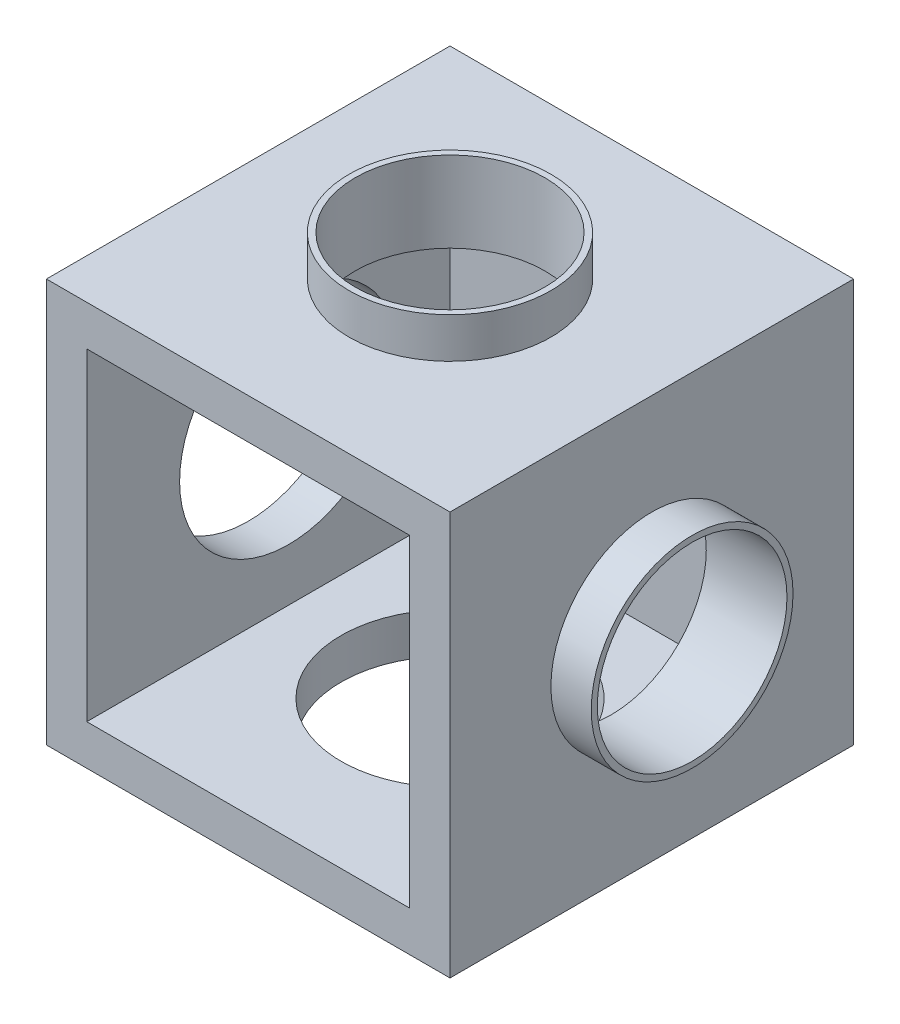
from build123d import *

# Parameters (mm, degrees)
SKETCH1_W           = 50
SKETCH1_H           = 50
BOSS_EXTRUDE1_DEPTH = 50
SKETCH2_W           = 40
SKETCH2_H           = 40
CUT_EXTRUDE1_DEPTH  = 45
SKETCH3_R           = 12.5
BOSS_EXTRUDE2_DEPTH = 5
SKETCH4_R           = 13.5
CUT_EXTRUDE2_DEPTH  = 5
SKETCH5_R           = 12.5
BOSS_EXTRUDE3_DEPTH = 5
SKETCH6_R           = 13.5
CUT_EXTRUDE3_DEPTH  = 5
SKETCH7_R           = 11.75
CUT_EXTRUDE4_DEPTH  = 10
SKETCH8_R           = 11.75
CUT_EXTRUDE5_DEPTH  = 10


with BuildPart() as part:
    # Sketch1 → Boss-Extrude1 (new body)
    with BuildSketch(Plane(origin=(0, 0, 0), x_dir=(1, 0, 0), z_dir=(0, 1, 0))):
        with Locations((25, 25)):
            Rectangle(SKETCH1_W, SKETCH1_H)
    extrude(amount=BOSS_EXTRUDE1_DEPTH)

    # Sketch2 → Cut-Extrude1 (cut)
    with BuildSketch(Plane.XY):
        with Locations((25, 25)):
            Rectangle(SKETCH2_W, SKETCH2_H)
    extrude(amount=-CUT_EXTRUDE1_DEPTH, mode=Mode.SUBTRACT)

    # Sketch3 → Boss-Extrude2 (add)
    with BuildSketch(Plane(origin=(0, 50, 0), x_dir=(1, 0, 0), z_dir=(0, 1, 0))):
        with Locations(Location((25, 25, 0), (0, 0, 90))):
            Circle(SKETCH3_R)
    extrude(amount=BOSS_EXTRUDE2_DEPTH)

    # Sketch4 → Cut-Extrude2 (cut)
    with BuildSketch(Plane.XZ):
        with Locations(Location((25, -25, 0), (0, 0, 270))):
            Circle(SKETCH4_R)
    extrude(amount=-CUT_EXTRUDE2_DEPTH, mode=Mode.SUBTRACT)

    # Sketch5 → Boss-Extrude3 (add)
    with BuildSketch(Plane(origin=(50, 0, 0), x_dir=(0, 0, -1), z_dir=(1, 0, 0))):
        with Locations(Location((25, 25, 0), (0, 0, 180))):
            Circle(SKETCH5_R)
    extrude(amount=BOSS_EXTRUDE3_DEPTH)

    # Sketch6 → Cut-Extrude3 (cut)
    with BuildSketch(Plane.ZY):
        with Locations((-25, 25)):
            Circle(SKETCH6_R)
    extrude(amount=-CUT_EXTRUDE3_DEPTH, mode=Mode.SUBTRACT)

    # Sketch7 → Cut-Extrude4 (cut)
    with BuildSketch(Plane(origin=(0, 55, 0), x_dir=(1, 0, 0), z_dir=(0, 1, 0))):
        with Locations(Location((25, 25, 0), (0, 0, 270))):
            Circle(SKETCH7_R)
    extrude(amount=-CUT_EXTRUDE4_DEPTH, mode=Mode.SUBTRACT)

    # Sketch8 → Cut-Extrude5 (cut)
    with BuildSketch(Plane(origin=(55, 0, 0), x_dir=(0, 0, -1), z_dir=(1, 0, 0))):
        with Locations((25, 25)):
            Circle(SKETCH8_R)
    extrude(amount=-CUT_EXTRUDE5_DEPTH, mode=Mode.SUBTRACT)


solid = part.part
